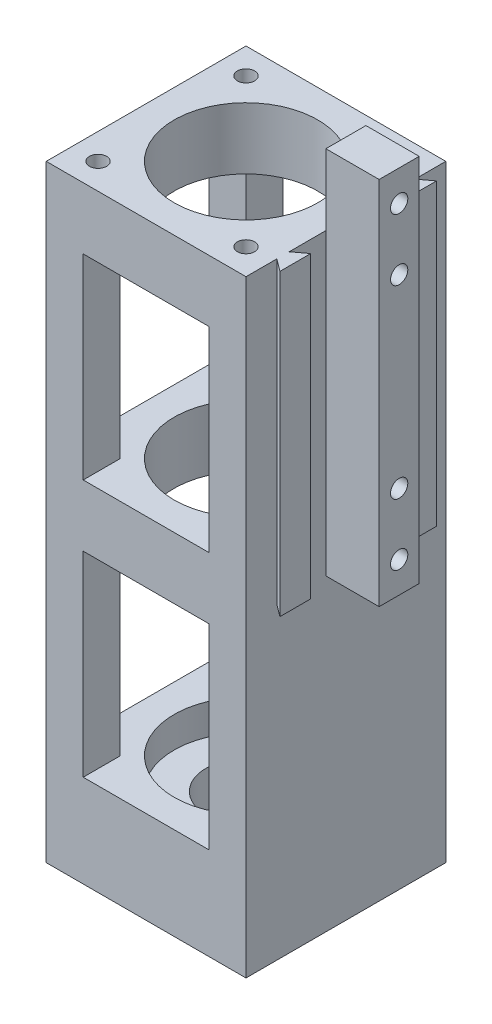
from build123d import *

# Parameters (mm, degrees)
SKETCH1_W                 = 32.4
SKETCH1_H                 = 32.4
BOSS_EXTRUDE1_DEPTH       = 98.5
SKETCH2_R                 = 11.65
CUT_EXTRUDE1_DEPTH        = 88.5
SKETCH3_R                 = 6.5
CUT_EXTRUDE2_DEPTH        = 99.398410022
F_1_0MM_DOWEL_HOLE1_D     = 2.8
F_1_0MM_DOWEL_HOLE1_DEPTH = 7
F_1_0MM_DOWEL_HOLE1_TIP   = 0.841204867
SKETCH7_R                 = 2.5
CUT_EXTRUDE3_DEPTH        = 14
SKETCH8_W                 = 6.5
SKETCH8_H                 = 98.5
BOSS_EXTRUDE2_DEPTH       = 8.64
SKETCH14_W                = 30.956114244
SKETCH14_H                = 32.4
CUT_EXTRUDE6_DEPTH        = 50
SKETCH11_W                = 20.4
SKETCH11_H                = 31.75
CUT_EXTRUDE4_DEPTH        = 107.197037106
SKETCH12_W                = 20.4
SKETCH12_H                = 31.75
CUT_EXTRUDE5_DEPTH        = 15
SKETCH23_W                = 8.64
SKETCH23_H                = 6.5
BOSS_EXTRUDE3_DEPTH       = 11.5
F_1_0MM_DOWEL_HOLE3_D     = 2.8
F_1_0MM_DOWEL_HOLE3_DEPTH = 5
F_1_0MM_DOWEL_HOLE3_TIP   = 0.841204867


with BuildPart() as part:
    # Sketch1 → Boss-Extrude1 (new body)
    with BuildSketch(Plane(origin=(0, 0, 0), x_dir=(1, 0, 0), z_dir=(0, 1, 0))):
        with Locations((-6.730344165, -20.189509634)):
            Rectangle(SKETCH1_W, SKETCH1_H)
        Polygon((11.469655835, -27.889509634), (9.469655835, -29.389509634), (9.469655835, -31.389509634), (11.469655835, -32.889509634), align=None)
        Polygon((11.469655835, -7.489509634), (9.469655835, -8.989509634), (9.469655835, -10.989509634), (11.469655835, -12.489509634), align=None)
    extrude(amount=BOSS_EXTRUDE1_DEPTH)

    # Sketch2 → Cut-Extrude1 (cut)
    with BuildSketch(Plane(origin=(0, 98.5, 0), x_dir=(1, 0, 0), z_dir=(0, 1, 0))):
        with Locations(Location((-6.730344165, -20.189509634, 0), (0, 0, 270))):
            Circle(SKETCH2_R)
    extrude(amount=-CUT_EXTRUDE1_DEPTH, mode=Mode.SUBTRACT)

    # Sketch3 → Cut-Extrude2 (cut, through all)
    with BuildSketch(Plane(origin=(0, 10, 0), x_dir=(1, 0, 0), z_dir=(0, 1, 0))):
        with Locations(Location((-6.730344165, -20.189509634, 0), (0, 0, 270))):
            Circle(SKETCH3_R)
    extrude(amount=-CUT_EXTRUDE2_DEPTH, mode=Mode.SUBTRACT)

    # Ø1.0mm Dowel Hole1
    with Locations(Plane(origin=(0, 98.5, 0), x_dir=(1, 0, 0), z_dir=(0, 1, 0))):
        with Locations((-18.730344165, -8.189509634), (5.269655835, -8.189509634), (5.269655835, -32.189509634), (-18.730344165, -32.189509634)):
            Hole(F_1_0MM_DOWEL_HOLE1_D / 2, depth=F_1_0MM_DOWEL_HOLE1_DEPTH)
            with Locations((0, 0, -(F_1_0MM_DOWEL_HOLE1_DEPTH + F_1_0MM_DOWEL_HOLE1_TIP / 2))):  # 118° drill point
                Cone(0, F_1_0MM_DOWEL_HOLE1_D / 2, F_1_0MM_DOWEL_HOLE1_TIP, mode=Mode.SUBTRACT)

    # Sketch7 → Cut-Extrude3 (cut)
    with BuildSketch(Plane(origin=(0, 0, 3.989509634), x_dir=(-1, 0, 0), z_dir=(0, 0, -1))):
        with Locations((6.730344165, 4.5)):
            Circle(SKETCH7_R)
    extrude(amount=-CUT_EXTRUDE3_DEPTH, mode=Mode.SUBTRACT)

    # Sketch8 → Boss-Extrude2 (add)
    with BuildSketch(Plane(origin=(9.469655835, 0, 0), x_dir=(0, 0, -1), z_dir=(1, 0, 0))):
        with Locations((-20.189509634, 49.25)):
            Rectangle(SKETCH8_W, SKETCH8_H)
    extrude(amount=BOSS_EXTRUDE2_DEPTH)

    # Sketch14 → Cut-Extrude6 (cut)
    with BuildSketch(Plane.XZ):
        with Locations((24.947712957, 20.189509634)):
            Rectangle(SKETCH14_W, SKETCH14_H)
    extrude(amount=-CUT_EXTRUDE6_DEPTH, mode=Mode.SUBTRACT)

    # Sketch11 → Cut-Extrude4 (cut, through all)
    with BuildSketch(Plane.XY.offset(36.389509634)):
        with Locations((-6.730344165, 72.625)):
            Rectangle(SKETCH11_W, SKETCH11_H)
        with Locations((-6.730344165, 30.875)):
            Rectangle(SKETCH11_W, SKETCH11_H)
    extrude(amount=-CUT_EXTRUDE4_DEPTH, mode=Mode.SUBTRACT)

    # Sketch12 → Cut-Extrude5 (cut)
    with BuildSketch(Plane.ZY.offset(22.930344165)):
        with Locations((20.189509634, 72.625)):
            Rectangle(SKETCH12_W, SKETCH12_H)
        with Locations((20.189509634, 30.875)):
            Rectangle(SKETCH12_W, SKETCH12_H)
    extrude(amount=-CUT_EXTRUDE5_DEPTH, mode=Mode.SUBTRACT)

    # Sketch23 → Boss-Extrude3 (add)
    with BuildSketch(Plane(origin=(0, 98.5, 0), x_dir=(1, 0, 0), z_dir=(0, 1, 0))):
        with Locations((13.789655835, -20.189509634)):
            Rectangle(SKETCH23_W, SKETCH23_H)
    extrude(amount=BOSS_EXTRUDE3_DEPTH)

    # Ø1.0mm Dowel Hole3
    with Locations(Plane(origin=(18.109655835, 0, 0), x_dir=(0, 0, -1), z_dir=(1, 0, 0))):
        with Locations((-20.189509634, 105), (-20.189509634, 55), (-20.189509634, 65), (-20.189509634, 95)):
            Hole(F_1_0MM_DOWEL_HOLE3_D / 2, depth=F_1_0MM_DOWEL_HOLE3_DEPTH)
            with Locations((0, 0, -(F_1_0MM_DOWEL_HOLE3_DEPTH + F_1_0MM_DOWEL_HOLE3_TIP / 2))):  # 118° drill point
                Cone(0, F_1_0MM_DOWEL_HOLE3_D / 2, F_1_0MM_DOWEL_HOLE3_TIP, mode=Mode.SUBTRACT)


solid = part.part
